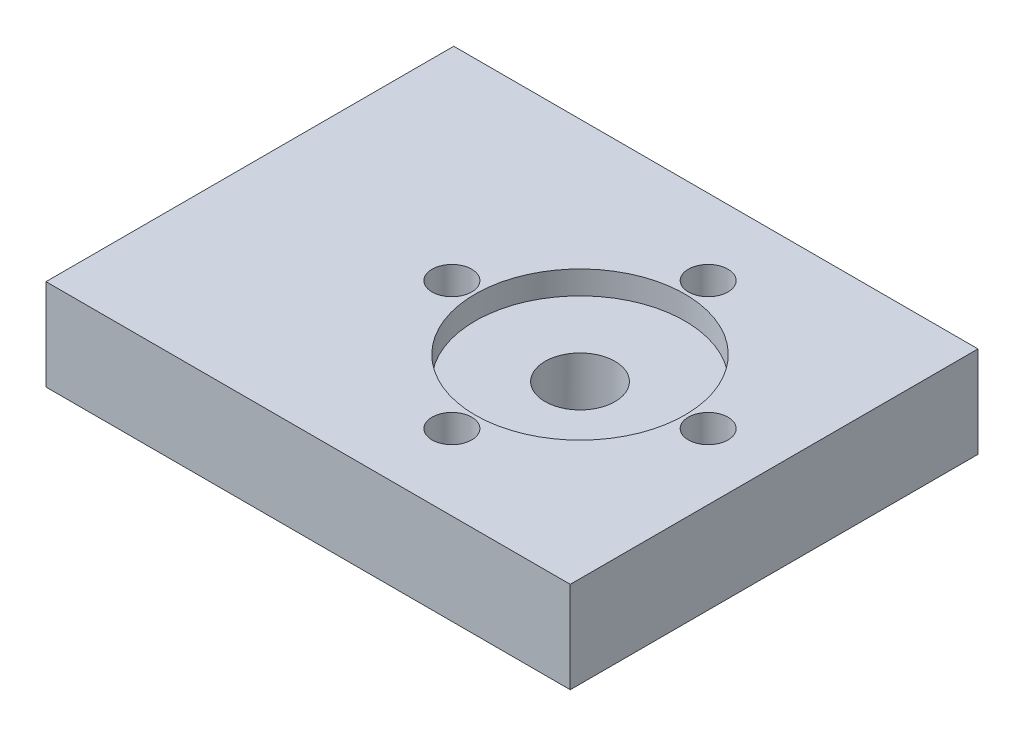
from build123d import *

# Parameters (mm, degrees)
SKETCH1_W           = 45
SKETCH1_H           = 35
BOSS_EXTRUDE1_DEPTH = 7.838444594
SKETCH4_R           = 9
CUT_EXTRUDE3_DEPTH  = 2
SKETCH5_R           = 1.7
SKETCH5_R_2         = 3
CUT_EXTRUDE4_DEPTH  = 7.838444594


with BuildPart() as part:
    # Sketch1 → Boss-Extrude1 (new body)
    with BuildSketch(Plane(origin=(0, 0, 0), x_dir=(1, 0, 0), z_dir=(0, 1, 0))):
        Rectangle(SKETCH1_W, SKETCH1_H)
    extrude(amount=BOSS_EXTRUDE1_DEPTH)

    # Sketch4 → Cut-Extrude3 (cut)
    with BuildSketch(Plane(origin=(0, 7.838444594, 0), x_dir=(1, 0, 0), z_dir=(0, 1, 0))):
        with Locations(Location((5.84, 0, 0), (0, 0, 270))):
            Circle(SKETCH4_R)
    extrude(amount=-CUT_EXTRUDE3_DEPTH, mode=Mode.SUBTRACT)

    # Sketch5 → Cut-Extrude4 (cut)
    with BuildSketch(Plane(origin=(0, 7.838444594, 0), x_dir=(1, 0, 0), z_dir=(0, 1, 0))):
        with Locations(Location((5.84, 11, 0), (0, 0, 270))):
            Circle(SKETCH5_R)
        with Locations(Location((16.84, 0, 0), (0, 0, 270))):
            Circle(SKETCH5_R)
        with Locations(Location((5.84, -11, 0), (0, 0, 270))):
            Circle(SKETCH5_R)
        with Locations(Location((-5.16, 0, 0), (0, 0, 270))):
            Circle(SKETCH5_R)
        with Locations(Location((5.84, 0, 0), (0, 0, 270))):
            Circle(SKETCH5_R_2)
    extrude(amount=-CUT_EXTRUDE4_DEPTH, mode=Mode.SUBTRACT)


solid = part.part
